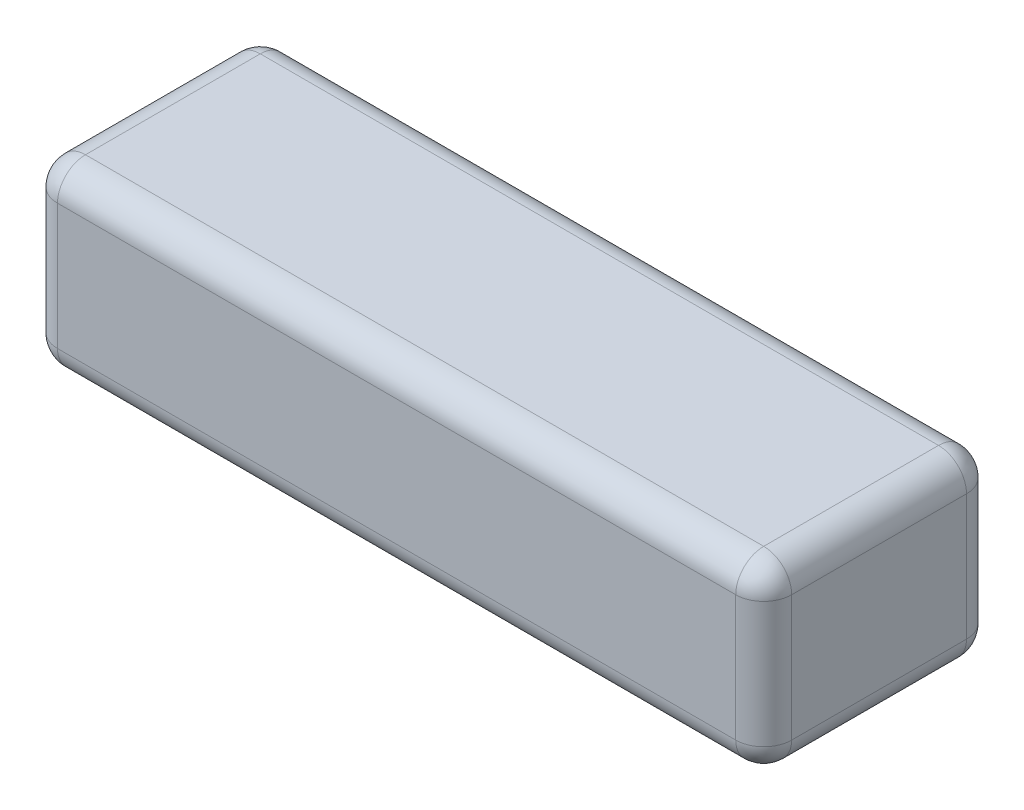
from build123d import *

# Parameters (mm, degrees)
SKETCH2_W           = 105
SKETCH2_H           = 33
BOSS_EXTRUDE1_DEPTH = 26
FILLET1_R           = 4


with BuildPart() as part:
    # Sketch2 → Boss-Extrude1 (new body)
    with BuildSketch(Plane(origin=(0, 0, 0), x_dir=(1, 0, 0), z_dir=(0, 1, 0))):
        with Locations((52.5, 16.5)):
            Rectangle(SKETCH2_W, SKETCH2_H)
    extrude(amount=BOSS_EXTRUDE1_DEPTH)

    # Fillet1
    fillet1_edges = [part.edges().sort_by_distance(p)[0] for p in [
        (105, 26, -16.5),
        (52.5, 26, -33),
        (0, 26, -16.5),
        (52.5, 0, -33),
        (105, 0, -16.5),
        (52.5, 0, 0),
        (0, 0, -16.5),
        (52.5, 26, 0),
        (0, 13, -33),
        (105, 13, -33),
        (105, 13, 0),
        (0, 13, 0),
    ]]
    fillet(fillet1_edges, radius=FILLET1_R)


solid = part.part
